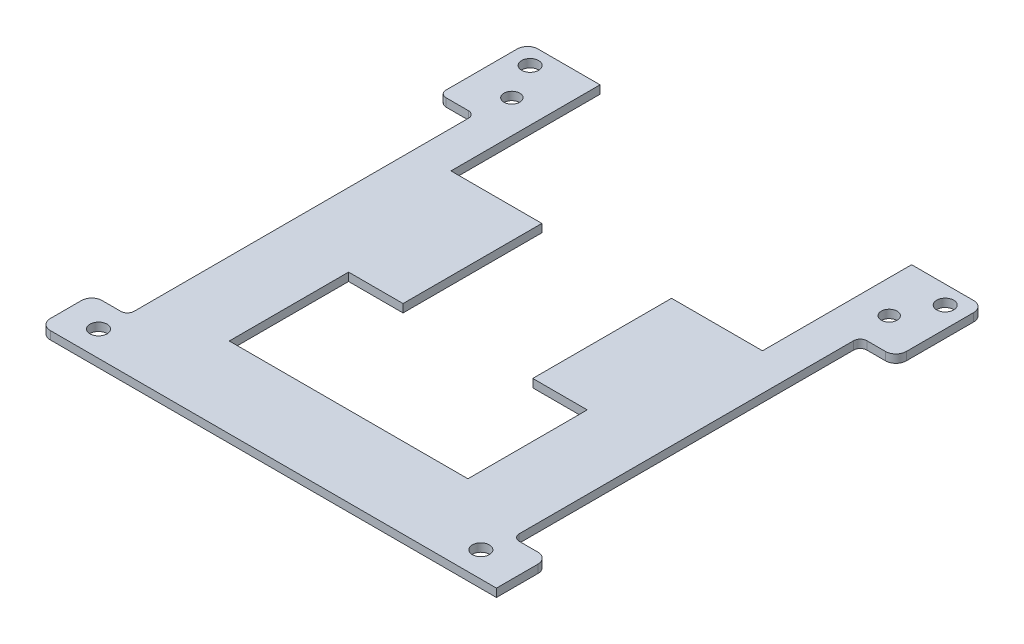
from build123d import *

# Parameters (mm, degrees)
SKETCH1_R           = 1.6383
BOSS_EXTRUDE1_DEPTH = 1.575
CUT_EXTRUDE1_DEPTH  = 2.54
SKETCH15_R          = 1.524
CUT_EXTRUDE5_DEPTH  = 1.575


with BuildPart() as part:
    # Sketch1 → Boss-Extrude1 (new body)
    with BuildSketch(Plane(origin=(0, 0, 0), x_dir=(1, 0, 0), z_dir=(0, 1, 0))):
        with BuildLine():
            Line((-38.395, 30), (-42.73, 30))
            ThreePointArc((-42.73, 30), (-43.628025612, 30.371974388), (-44, 31.27))
            Line((-44, 31.27), (-44, 45))
            ThreePointArc((-44, 45), (-43.414213562, 46.414213562), (-42, 47))
            Line((-42, 47), (42, 47))
            ThreePointArc((42, 47), (43.414213562, 46.414213562), (44, 45))
            Line((44, 45), (44, 32))
            ThreePointArc((44, 32), (43.414213562, 30.585786438), (42, 30))
            Line((42, 30), (38.395, 30))
            ThreePointArc((38.395, 30), (37.496974388, 29.628025612), (37.125, 28.73))
            Line((37.125, 28.73), (37.125, -35.73))
            ThreePointArc((37.125, -35.73), (37.496974388, -36.628025612), (38.395, -37))
            Line((38.395, -37), (42, -37))
            ThreePointArc((42, -37), (43.414213562, -37.585786438), (44, -39))
            Line((44, -39), (44, -47))
            Line((44, -47), (-42, -47))
            ThreePointArc((-42, -47), (-43.414213562, -46.414213562), (-44, -45))
            Line((-44, -45), (-44, -38.977))
            ThreePointArc((-44, -38.977), (-43.40945979, -37.574276641), (-42, -37))
            Line((-42, -37), (-38.395, -37))
            ThreePointArc((-38.395, -37), (-37.496974388, -36.628025612), (-37.125, -35.73))
            Line((-37.125, -35.73), (-37.125, 28.73))
            ThreePointArc((-37.125, 28.73), (-37.496974388, 29.628025612), (-38.395, 30))
        make_face()
        with Locations(Location((40, 43.5, 0), (0, 0, 270))):
            Circle(SKETCH1_R, mode=Mode.SUBTRACT)
        with Locations(Location((-40, 43.5, 0), (0, 0, 270))):
            Circle(SKETCH1_R, mode=Mode.SUBTRACT)
        with Locations(Location((-37.6, -42.1, 0), (0, 0, 270))):
            Circle(SKETCH1_R, mode=Mode.SUBTRACT)
        with Locations(Location((36.1, -42.1, 0), (0, 0, 270))):
            Circle(SKETCH1_R, mode=Mode.SUBTRACT)
        Polygon((23, -31.5), (-23, -31.5), (-23, -8.5), (-12.5, -8.5), (-12.5, 35), (12.5, 35), (12.5, -8.5), (23, -8.5), align=None, mode=Mode.SUBTRACT)
    extrude(amount=BOSS_EXTRUDE1_DEPTH)

    # Sketch2 → Cut-Extrude1 (cut)
    with BuildSketch(Plane(origin=(0, 1.575, 0), x_dir=(1, 0, 0), z_dir=(0, 1, 0))):
        Polygon((-12.5, 18.255354416), (-30.026, 18.255354416), (-30.026, 47), (30.026, 47), (30.026, 18.255354416), (12.5, 18.255354416), (12.5, 35), (-12.5, 35), align=None)
    extrude(amount=-CUT_EXTRUDE1_DEPTH, mode=Mode.SUBTRACT)

    # Sketch15 → Cut-Extrude5 (cut)
    with BuildSketch(Plane(origin=(0, 1.575, 0), x_dir=(1, 0, 0), z_dir=(0, 1, 0))):
        with Locations(Location((-36.376, 36.35, 0), (0, 0, 270))):
            Circle(SKETCH15_R)
        with Locations(Location((36.376, 36.332, 0), (0, 0, 270))):
            Circle(SKETCH15_R)
    extrude(amount=-CUT_EXTRUDE5_DEPTH, mode=Mode.SUBTRACT)


solid = part.part
